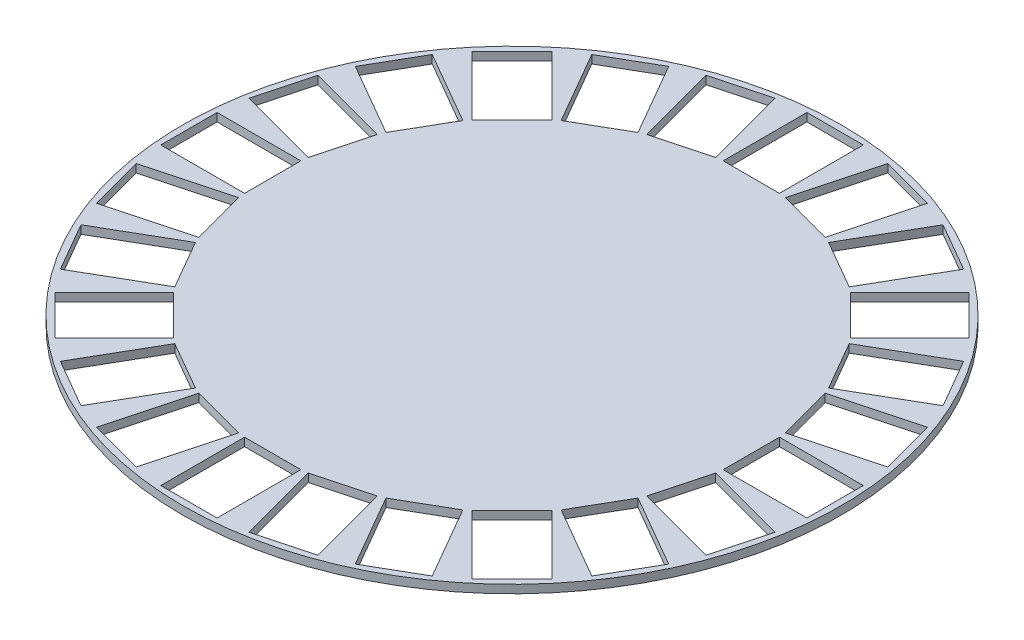
from build123d import *

# Parameters (mm, degrees)
SKETCH1_R           = 120
BOSS_EXTRUDE1_DEPTH = 1.5
SKETCH6_W           = 30.5
SKETCH6_H           = 20.5
SKETCH6_W_2         = 20.5
SKETCH6_H_2         = 30.5
CUT_EXTRUDE1_DEPTH  = 10.5


with BuildPart() as part:
    # Sketch1 → Boss-Extrude1 (new, symmetric)
    with BuildSketch(Plane(origin=(0, 0, 0), x_dir=(1, 0, 0), z_dir=(0, 1, 0))):
        with Locations((98.638798209, 0)):
            Circle(SKETCH1_R)
    extrude(amount=BOSS_EXTRUDE1_DEPTH, both=True)

    # Sketch6 → Cut-Extrude1 (cut)
    with BuildSketch(Plane(origin=(0, 1.5, 0), x_dir=(1, 0, 0), z_dir=(0, 1, 0))):
        with Locations((-3.75, 0)):
            Rectangle(SKETCH6_W, SKETCH6_H)
        Polygon((-12.338659942, 40.347901139), (-17.644450367, 20.5464217), (11.816287335, 12.652440824), (17.122077759, 32.453920263), align=None)
        Polygon((1.885610489, 67.696159493), (-8.364389511, 49.942638716), (18.049385305, 34.692638716), (28.299385305, 52.446159493), align=None)
        Polygon((22.703450772, 90.431036452), (8.207761758, 75.935347437), (29.774518584, 54.368590611), (44.270207598, 68.864279625), align=None)
        Polygon((48.696159493, 107.00318772), (30.942638716, 96.75318772), (46.192638716, 70.339412904), (63.946159493, 80.589412904), align=None)
        Polygon((78.092376509, 116.283248576), (58.29089707, 110.977458152), (66.184877946, 81.51672045), (85.986357385, 86.822510874), align=None)
        with Locations((98.638798209, 102.388798209)):
            Rectangle(SKETCH6_W_2, SKETCH6_H_2)
        Polygon((138.986699348, 110.977458152), (119.185219909, 116.283248576), (111.291239034, 86.822510874), (131.092718473, 81.51672045), align=None)
        Polygon((166.334957703, 96.75318772), (148.581436925, 107.00318772), (133.331436925, 80.589412904), (151.084957703, 70.339412904), align=None)
        Polygon((189.069834661, 75.935347437), (174.574145646, 90.431036452), (153.00738882, 68.864279625), (167.503077834, 54.368590611), align=None)
        Polygon((205.641985929, 49.942638716), (195.391985929, 67.696159493), (168.978211114, 52.446159493), (179.228211114, 34.692638716), align=None)
        Polygon((214.922046785, 20.5464217), (209.616256361, 40.347901139), (180.155518659, 32.453920263), (185.461309084, 12.652440824), align=None)
        with Locations((201.027596418, 0)):
            Rectangle(SKETCH6_W, SKETCH6_H)
        Polygon((209.616256361, -40.347901139), (214.922046785, -20.5464217), (185.461309084, -12.652440824), (180.155518659, -32.453920263), align=None)
        Polygon((195.391985929, -67.696159493), (205.641985929, -49.942638716), (179.228211114, -34.692638716), (168.978211114, -52.446159493), align=None)
        Polygon((174.574145646, -90.431036451), (189.069834661, -75.935347437), (167.503077835, -54.368590611), (153.00738882, -68.864279625), align=None)
        Polygon((148.581436925, -107.00318772), (166.334957703, -96.75318772), (151.084957703, -70.339412904), (133.331436925, -80.589412904), align=None)
        Polygon((119.185219909, -116.283248576), (138.986699348, -110.977458152), (131.092718473, -81.51672045), (111.291239034, -86.822510874), align=None)
        with Locations((98.638798209, -102.388798209)):
            Rectangle(SKETCH6_W_2, SKETCH6_H_2)
        Polygon((58.29089707, -110.977458152), (78.092376509, -116.283248576), (85.986357385, -86.822510874), (66.184877946, -81.51672045), align=None)
        Polygon((30.942638716, -96.75318772), (48.696159493, -107.00318772), (63.946159493, -80.589412904), (46.192638716, -70.339412904), align=None)
        Polygon((8.207761758, -75.935347437), (22.703450772, -90.431036452), (44.270207598, -68.864279625), (29.774518584, -54.368590611), align=None)
        Polygon((-8.364389511, -49.942638716), (1.885610489, -67.696159493), (28.299385305, -52.446159493), (18.049385305, -34.692638716), align=None)
        Polygon((-17.644450367, -20.5464217), (-12.338659942, -40.347901139), (17.122077759, -32.453920263), (11.816287335, -12.652440824), align=None)
    extrude(amount=-CUT_EXTRUDE1_DEPTH, mode=Mode.SUBTRACT)


solid = part.part
